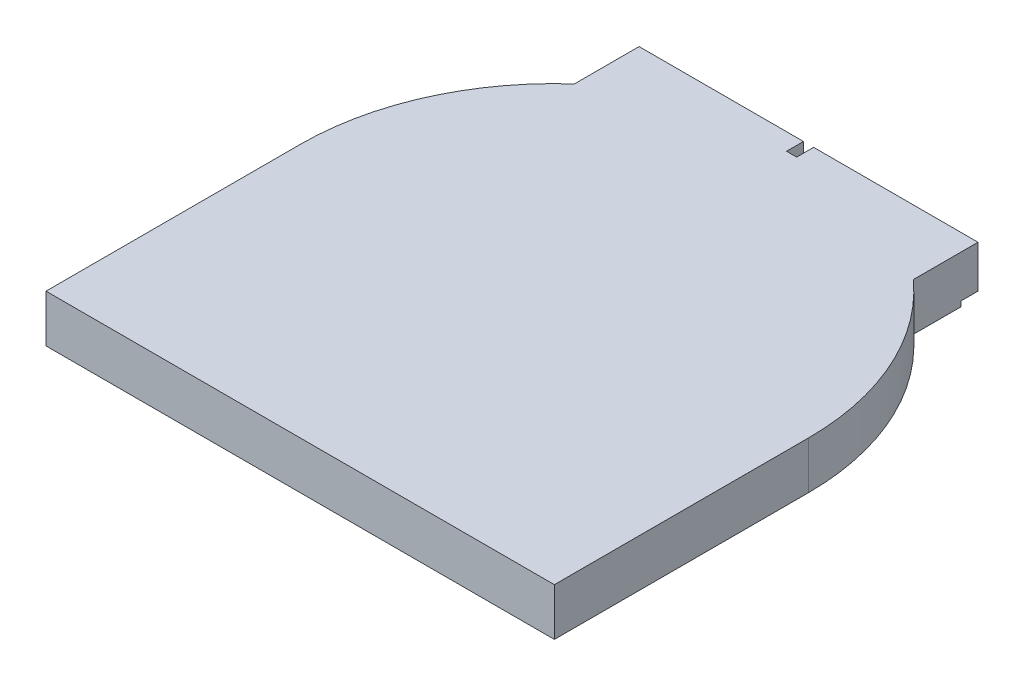
from build123d import *

# Parameters (mm, degrees)
BOSS_EXTRUDE1_DEPTH = 0.8
BOSS_EXTRUDE2_DEPTH = 1
BOSS_EXTRUDE3_START = 1
BOSS_EXTRUDE3_DEPTH = 1
CUT_EXTRUDE1_DEPTH  = 0.5
SKETCH5_W           = 18.969303985
SKETCH5_H           = 16.990491699
CUT_EXTRUDE2_DEPTH  = 4


with BuildPart() as part:
    # Sketch1 → Boss-Extrude1 (new body)
    with BuildSketch(Plane(origin=(0, 0, 0), x_dir=(1, 0, 0), z_dir=(0, 1, 0))):
        with BuildLine():
            Line((-5, 7.5), (-5, 5.590169944))
            ThreePointArc((-5, 5.590169944), (-6.846531969, 3.061862178), (-7.5, 0))
            Line((-7.5, 0), (-7.5, -7.5))
            Line((-7.5, -7.5), (7.5, -7.5))
            Line((7.5, -7.5), (7.5, 0))
            ThreePointArc((7.5, 0), (6.846531969, 3.061862178), (5, 5.590169944))
            Line((5, 5.590169944), (5, 7.5))
            Line((5, 7.5), (3, 7.5))
            Line((3, 7.5), (3, 5.5))
            Line((3, 5.5), (3, 5.123475383))
            ThreePointArc((3, 5.123475383), (3.101282966, 4.684946373), (3.384615385, 4.335248401))
            ThreePointArc((3.384615385, 4.335248401), (0, -5.5), (-3.384615385, 4.335248401))
            ThreePointArc((-3.384615385, 4.335248401), (-3.101282966, 4.684946373), (-3, 5.123475383))
            Line((-3, 5.123475383), (-3, 5.5))
            Line((-3, 5.5), (-3, 7.5))
            Line((-3, 7.5), (-5, 7.5))
        make_face()
    extrude(amount=BOSS_EXTRUDE1_DEPTH)

    # Sketch2 → Boss-Extrude2 (add)
    with BuildSketch(Plane(origin=(0, 0.8, 0), x_dir=(1, 0, 0), z_dir=(0, 1, 0))):
        with BuildLine():
            Line((5, 5.590169944), (5, 7.5))
            Line((5, 7.5), (3, 7.5))
            Line((3, 7.5), (-3, 7.5))
            Line((-3, 7.5), (-5, 7.5))
            Line((-5, 7.5), (-5, 5.590169944))
            ThreePointArc((-5, 5.590169944), (-6.846531969, 3.061862178), (-7.5, 0))
            Line((-7.5, 0), (-7.5, -7.5))
            Line((-7.5, -7.5), (7.5, -7.5))
            Line((7.5, -7.5), (7.5, 0))
            ThreePointArc((7.5, 0), (6.846531969, 3.061862178), (5, 5.590169944))
        make_face()
    extrude(amount=BOSS_EXTRUDE2_DEPTH)

    # Sketch3 → Boss-Extrude3 (add)
    with BuildSketch(Plane.XZ.offset(BOSS_EXTRUDE3_START)):
        with BuildLine():
            Line((-3, -7.5), (-5, -7.5))
            Line((-5, -7.5), (-5, -5.590169944))
            ThreePointArc((-5, -5.590169944), (-6.846531969, -3.061862178), (-7.5, 0))
            Line((-7.5, 0), (-7.5, 7.5))
            Line((-7.5, 7.5), (7.5, 7.5))
            Line((7.5, 7.5), (7.5, 0))
            ThreePointArc((7.5, 0), (6.846531969, -3.061862178), (5, -5.590169944))
            Line((5, -5.590169944), (5, -7.5))
            Line((5, -7.5), (3, -7.5))
            Line((3, -7.5), (-3, -7.5))
        make_face()
    extrude(amount=-BOSS_EXTRUDE3_DEPTH)

    # Sketch4 → Cut-Extrude1 (cut)
    with BuildSketch(Plane(origin=(0, 0, -7.5), x_dir=(-1, 0, 0), z_dir=(0, 0, -1))):
        Polygon((-5, 0.55), (-0.15, 0.55), (-0.15, 1.8), (0.15, 1.8), (0.15, 0.55), (5, 0.55), (5, 0.25), (0.15, 0.25), (0.15, -1), (-0.15, -1), (-0.15, 0.25), (-5, 0.25), align=None)
    extrude(amount=-CUT_EXTRUDE1_DEPTH, mode=Mode.SUBTRACT)

    # Sketch5 → Cut-Extrude2 (cut)
    with BuildSketch(Plane(origin=(0, 0.4, 0), x_dir=(-1, 0, 0), z_dir=(0, -1, 0))):
        with Locations((0.318429563, 0.045489938)):
            Rectangle(SKETCH5_W, SKETCH5_H)
    extrude(amount=CUT_EXTRUDE2_DEPTH, mode=Mode.SUBTRACT)


solid = part.part
